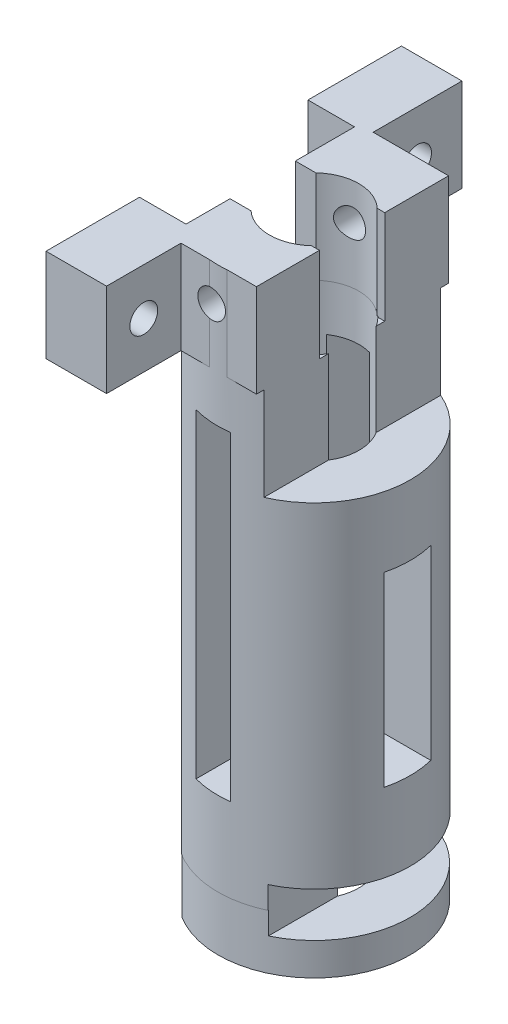
from build123d import *

# Parameters (mm, degrees)
SKETCH_1_R           = 20.68
SKETCH_1_R_2         = 9.68
EXTRUDE_1_DEPTH      = 116.68
SKETCH_11_W          = 27
SKETCH_11_H          = 150
CUT_EXTRUDE_3_DEPTH  = 40
SKETCH_13_W          = 10
SKETCH_13_H          = 128.345013401
CUT_EXTRUDE_7_DEPTH  = 126.614916312
SKETCH_15_W          = 8
SKETCH_15_H          = 68.68
CUT_EXTRUDE_9_DEPTH  = 48
SKETCH_16_W          = 15.549431524
SKETCH_16_H          = 20
SKETCH_16_W_2        = 15.459431524
EXTRUDE_4_DEPTH      = 19.2
SKETCH_17_W          = 19.20851187
SKETCH_17_H          = 14.03
CUT_EXTRUDE_10_DEPTH = 20.2
SKETCH_18_R          = 9.59
CUT_EXTRUDE_11_DEPTH = 121.289430957
SKETCH_21_R          = 2.985
CUT_EXTRUDE_12_DEPTH = 55.2
EXTRUDE_START        = 55.2
SKETCH_24_R          = 20.59
SKETCH_24_R_2        = 9.59
EXTRUDE_2_DEPTH      = 55.2
CUT_EXTRUDE_13_DEPTH = 55.2
SKETCH_26_W          = 10.00851187
SKETCH_26_H          = 41.68
CUT_EXTRUDE_15_DEPTH = 55.2
SKETCH_27_W          = 10
SKETCH_27_H          = 40
CUT_EXTRUDE_16_DEPTH = 55.2
SKETCH_28_W          = 44.880694938
SKETCH_28_H          = 9.608044066
CUT_EXTRUDE_17_DEPTH = 12.2
SKETCH_35_W          = 13.53
SKETCH_35_H          = 20
EXTRUDE_10_DEPTH     = 15
EXTRUDE_11_DEPTH     = 15
SKETCH_37_W          = 9
SKETCH_37_H          = 20
EXTRUDE_12_DEPTH     = 20
SKETCH_38_W          = 9
SKETCH_38_H          = 20
EXTRUDE_13_DEPTH     = 20
SKETCH_42_R          = 2.985
CUT_EXTRUDE_21_DEPTH = 20
CUT_EXTRUDE_23_DEPTH = 138.235841092
SKETCH_45_W          = 3
SKETCH_45_H          = 20
EXTRUDE_14_DEPTH     = 30
SKETCH_46_W          = 3
SKETCH_46_H          = 20
EXTRUDE_15_DEPTH     = 30
SKETCH_47_W          = 33.078221107
SKETCH_47_H          = 20
EXTRUDE_16_DEPTH     = 50
SKETCH_48_W          = 30
SKETCH_48_H          = 20
EXTRUDE_17_DEPTH     = 50
SKETCH_50_W          = 50
SKETCH_50_H          = 20
EXTRUDE_18_DEPTH     = 1
SKETCH_51_W          = 50
SKETCH_51_H          = 20
EXTRUDE_19_DEPTH     = 1
SKETCH_52_W          = 53
SKETCH_52_H          = 14
CUT_EXTRUDE_24_DEPTH = 151.972575738
SKETCH_53_W          = 53
SKETCH_53_H          = 14
CUT_EXTRUDE_25_DEPTH = 151.942387436
SKETCH_54_W          = 40
SKETCH_54_H          = 73.27
CUT_EXTRUDE_26_DEPTH = 147.866192927
SKETCH_56_W          = 13.00851187
SKETCH_56_H          = 20
EXTRUDE_21_DEPTH     = 3.08
SKETCH_57_R          = 2.985
CUT_EXTRUDE_27_DEPTH = 127.558817396


with BuildPart() as part:
    # 草圖1 → 伸長-薄件1 (new body)
    with BuildSketch(Plane(origin=(0, 0, 0), x_dir=(1, 0, 0), z_dir=(0, 1, 0))):
        Circle(SKETCH_1_R)
        Circle(SKETCH_1_R_2, mode=Mode.SUBTRACT)
    extrude(amount=EXTRUDE_1_DEPTH)

    # 草圖11 → 除料-伸長3 (cut)
    with BuildSketch(Plane(origin=(0, 116.68, 0), x_dir=(1, 0, 0), z_dir=(0, 1, 0))):
        with Locations((21.70851187, -44.235815192)):
            Rectangle(SKETCH_11_W, SKETCH_11_H)
    extrude(amount=-CUT_EXTRUDE_3_DEPTH, mode=Mode.SUBTRACT)

    # 草圖13 → 除料-伸長7 (cut, through all)
    with BuildSketch(Plane.XY.offset(21)):
        with Locations((-16, 58.612182466)):
            Rectangle(SKETCH_13_W, SKETCH_13_H)
    extrude(amount=-CUT_EXTRUDE_7_DEPTH, mode=Mode.SUBTRACT)

    # 草圖15 → 除料-伸長9 (cut)
    with BuildSketch(Plane.XY.offset(21)):
        with Locations((-1.395744065, 52.34)):
            Rectangle(SKETCH_15_W, SKETCH_15_H)
    extrude(amount=-CUT_EXTRUDE_9_DEPTH, mode=Mode.SUBTRACT)

    # 草圖16 → 填料-伸長4 (add)
    with BuildSketch(Plane(origin=(8.20851187, 0, 0), x_dir=(0, 0, -1), z_dir=(1, 0, 0))):
        with Locations((12.905284238, 106.68)):
            Rectangle(SKETCH_16_W, SKETCH_16_H)
        with Locations((-12.860284238, 106.68)):
            Rectangle(SKETCH_16_W_2, SKETCH_16_H)
    extrude(amount=-EXTRUDE_4_DEPTH)

    # 草圖17 → 除料-伸長10 (cut)
    with BuildSketch(Plane(origin=(0, 116.68, 0), x_dir=(1, 0, 0), z_dir=(0, 1, 0))):
        with Locations((-1.395744065, -0.045)):
            Rectangle(SKETCH_17_W, SKETCH_17_H)
    extrude(amount=-CUT_EXTRUDE_10_DEPTH, mode=Mode.SUBTRACT)

    # 草圖18 → 除料-伸長11 (cut, through all)
    with BuildSketch(Plane.XZ):
        with Locations(Location((0, 0, 0), (0, 0, 90))):
            Circle(SKETCH_18_R)
    extrude(amount=-CUT_EXTRUDE_11_DEPTH, mode=Mode.SUBTRACT)

    # 草圖21 → 除料-伸長12 (cut)
    with BuildSketch(Plane(origin=(0, 0, -20.68), x_dir=(-1, 0, 0), z_dir=(0, 0, -1))):
        with Locations((1.39148813, 108.73)):
            Circle(SKETCH_21_R)
    extrude(amount=-CUT_EXTRUDE_12_DEPTH, mode=Mode.SUBTRACT)

    # 草圖24 → 伸長-薄件2 (add)
    with BuildSketch(Plane.XZ.offset(EXTRUDE_START)):
        Circle(SKETCH_24_R)
        Circle(SKETCH_24_R_2, mode=Mode.SUBTRACT)
    extrude(amount=-EXTRUDE_2_DEPTH)

    # 草圖25 → 除料-伸長13 (cut)
    with BuildSketch(Plane.XY.offset(21)):
        Polygon((-1.39148813, -11.785), (22.612379708, -11.785), (22.612379708, -63.873337429), (-22.749525245, -63.873337429), (-22.749525245, -11.785), align=None)
    extrude(amount=-CUT_EXTRUDE_13_DEPTH, mode=Mode.SUBTRACT)

    # 草圖26 → 除料-伸長15 (cut)
    with BuildSketch(Plane(origin=(0, 0, 0), x_dir=(1, 0, 0), z_dir=(0, 1, 0))):
        with Locations((-15.995744065, -0.16)):
            Rectangle(SKETCH_26_W, SKETCH_26_H)
    extrude(amount=-CUT_EXTRUDE_15_DEPTH, mode=Mode.SUBTRACT)

    # 草圖27 → 除料-伸長16 (cut)
    with BuildSketch(Plane(origin=(21, 0, 0), x_dir=(0, 0, -1), z_dir=(1, 0, 0))):
        with Locations((0, 41.68)):
            Rectangle(SKETCH_27_W, SKETCH_27_H)
    extrude(amount=-CUT_EXTRUDE_16_DEPTH, mode=Mode.SUBTRACT)

    # 草圖28 → 除料-伸長17 (cut)
    with BuildSketch(Plane(origin=(21, 0, 0), x_dir=(0, 0, -1), z_dir=(1, 0, 0))):
        Rectangle(SKETCH_28_W, SKETCH_28_H)
    extrude(amount=-CUT_EXTRUDE_17_DEPTH, mode=Mode.SUBTRACT)

    # 草圖35 → 填料-伸長10 (add)
    with BuildSketch(Plane.ZY.offset(10.99148813)):
        with Locations((13.825, 106.68)):
            Rectangle(SKETCH_35_W, SKETCH_35_H)
    extrude(amount=EXTRUDE_10_DEPTH)

    # 草圖36 → 填料-伸長11 (add)
    with BuildSketch(Plane.ZY.offset(10.99148813)):
        Polygon((-20.68, 116.68), (-6.97, 116.68), (-6.97, 96.48), (-20.68, 96.68), align=None)
    extrude(amount=EXTRUDE_11_DEPTH)

    # 草圖37 → 填料-伸長12 (add)
    with BuildSketch(Plane.XY.offset(20.59)):
        with Locations((-21.49148813, 106.68)):
            Rectangle(SKETCH_37_W, SKETCH_37_H)
    extrude(amount=EXTRUDE_12_DEPTH)

    # 草圖38 → 填料-伸長13 (add)
    with BuildSketch(Plane(origin=(0, 0, -20.68), x_dir=(-1, 0, 0), z_dir=(0, 0, -1))):
        with Locations((21.49148813, 106.68)):
            Rectangle(SKETCH_38_W, SKETCH_38_H)
    extrude(amount=EXTRUDE_13_DEPTH)

    # 草圖42 → 除料-伸長21 (cut)
    with BuildSketch(Plane(origin=(-16.99148813, 0, 0), x_dir=(0, 0, -1), z_dir=(1, 0, 0))):
        with Locations((30.68, 106.554418142)):
            Circle(SKETCH_42_R)
        with Locations((-30.395640125, 106.68)):
            Circle(SKETCH_42_R)
    extrude(amount=-CUT_EXTRUDE_21_DEPTH, mode=Mode.SUBTRACT)

    # 草圖43 → 除料-伸長23 (cut, through all)
    with BuildSketch(Plane(origin=(0, 116.68, 0), x_dir=(1, 0, 0), z_dir=(0, 1, 0))):
        Polygon((-11, 6.97), (-10.99148813, 20.68), (-10.99148813, 48.096794253), (-28.274756234, 48.096794253), (-28.274756234, -43.270506289), (-11, -43.270506289), align=None)
    extrude(amount=-CUT_EXTRUDE_23_DEPTH, mode=Mode.SUBTRACT)

    # 草圖45 → 填料-伸長14 (add)
    with BuildSketch(Plane.XY.offset(20.59)):
        with Locations((-9.5, 106.68)):
            Rectangle(SKETCH_45_W, SKETCH_45_H)
    extrude(amount=EXTRUDE_14_DEPTH)

    # 草圖46 → 填料-伸長15 (add)
    with BuildSketch(Plane(origin=(0, 0, -20.68), x_dir=(-1, 0, 0), z_dir=(0, 0, -1))):
        with Locations((9.49148813, 106.68)):
            Rectangle(SKETCH_46_W, SKETCH_46_H)
    extrude(amount=EXTRUDE_15_DEPTH)

    # 草圖47 → 填料-伸長16 (add)
    with BuildSketch(Plane.ZY.offset(11)):
        with Locations((34.050889447, 106.68)):
            Rectangle(SKETCH_47_W, SKETCH_47_H)
    extrude(amount=EXTRUDE_16_DEPTH)

    # 草圖48 → 填料-伸長17 (add)
    with BuildSketch(Plane.ZY.offset(10.99148813)):
        with Locations((-35.68, 106.68)):
            Rectangle(SKETCH_48_W, SKETCH_48_H)
    extrude(amount=EXTRUDE_17_DEPTH)

    # 草圖50 → 填料-伸長18 (add)
    with BuildSketch(Plane(origin=(0, 0, 17.511778893), x_dir=(-1, 0, 0), z_dir=(0, 0, -1))):
        with Locations((36, 106.68)):
            Rectangle(SKETCH_50_W, SKETCH_50_H)
    extrude(amount=EXTRUDE_18_DEPTH)

    # 草圖51 → 填料-伸長19 (add)
    with BuildSketch(Plane.XY.offset(-20.68)):
        with Locations((-35.99148813, 106.68)):
            Rectangle(SKETCH_51_W, SKETCH_51_H)
    extrude(amount=EXTRUDE_19_DEPTH)

    # 草圖52 → 除料-伸長24 (cut, through all)
    with BuildSketch(Plane(origin=(0, 116.68, 0), x_dir=(1, 0, 0), z_dir=(0, 1, 0))):
        with Locations((-34.49148813, 43.68)):
            Rectangle(SKETCH_52_W, SKETCH_52_H)
    extrude(amount=-CUT_EXTRUDE_24_DEPTH, mode=Mode.SUBTRACT)

    # 草圖53 → 除料-伸長25 (cut, through all)
    with BuildSketch(Plane(origin=(0, 116.68, 0), x_dir=(1, 0, 0), z_dir=(0, 1, 0))):
        with Locations((-34.5, -43.59)):
            Rectangle(SKETCH_53_W, SKETCH_53_H)
    extrude(amount=-CUT_EXTRUDE_25_DEPTH, mode=Mode.SUBTRACT)

    # 草圖54 → 除料-伸長26 (cut, through all)
    with BuildSketch(Plane(origin=(0, 116.68, 0), x_dir=(1, 0, 0), z_dir=(0, 1, 0))):
        with Locations((-41, 0.045)):
            Rectangle(SKETCH_54_W, SKETCH_54_H)
    extrude(amount=-CUT_EXTRUDE_26_DEPTH, mode=Mode.SUBTRACT)

    # 草圖56 → 填料-伸長21 (add)
    with BuildSketch(Plane(origin=(0, 0, -36.68), x_dir=(-1, 0, 0), z_dir=(0, 0, -1))):
        with Locations((14.495744065, 106.68)):
            Rectangle(SKETCH_56_W, SKETCH_56_H)
    extrude(amount=EXTRUDE_21_DEPTH)

    # 草圖57 → 除料-伸長27 (cut, through all)
    with BuildSketch(Plane(origin=(-7.99148813, 0, 0), x_dir=(0, 0, -1), z_dir=(1, 0, 0))):
        with Locations((30.22, 106.634392252)):
            Circle(SKETCH_57_R)
        with Locations((-28.59, 106.68)):
            Circle(SKETCH_57_R)
    extrude(amount=-CUT_EXTRUDE_27_DEPTH, mode=Mode.SUBTRACT)


solid = part.part
